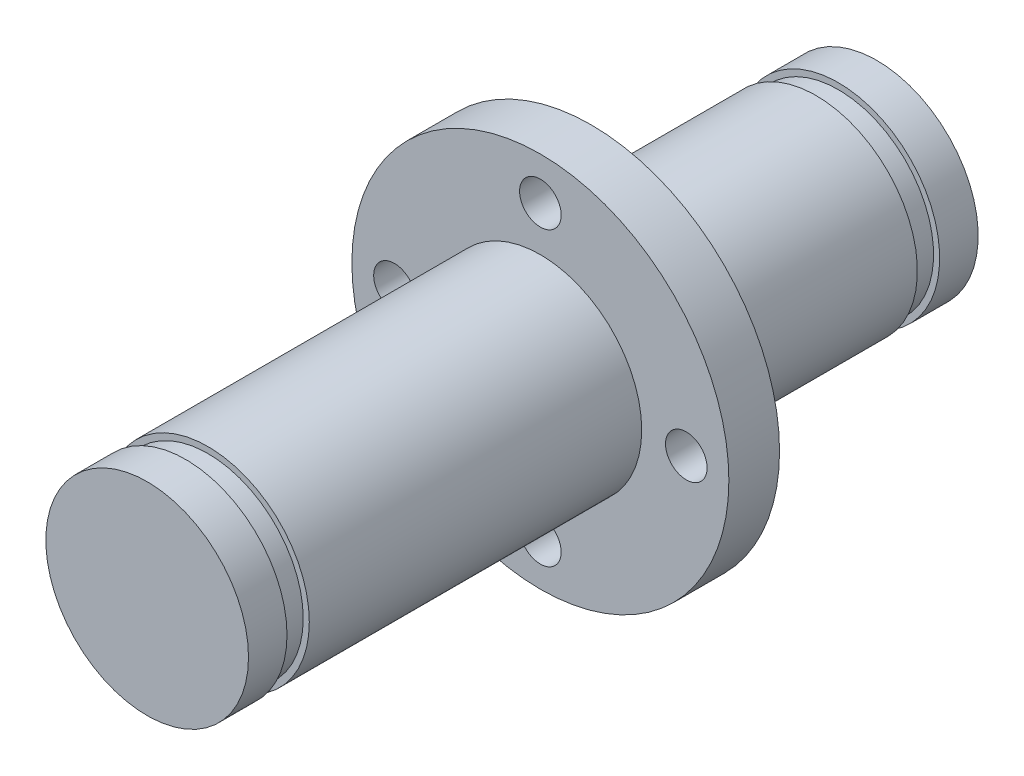
from build123d import *

# Parameters (mm, degrees)
SKETCH_1_R               = 5
EXTRUDE_1_DEPTH          = 19.4
SKETCH_2_R               = 9.3
EXTRUDE_2_DEPTH          = 2.5
EXTRUDE_START            = 14.1
SKETCH_3_R               = 5
EXTRUDE_3_DEPTH          = 14.1
SKETCH_5_W               = 0.3
SKETCH_5_H               = 1.1
SKETCH_6_W               = 0.3
SKETCH_6_H               = 1.1
HOLE_WIZARD_M2_5_2_D     = 2.05
HOLE_WIZARD_M2_5_2_DEPTH = 7.25
HOLE_WIZARD_M2_5_2_TIP   = 0.591784026
SKETCH_12_R              = 2
CUT_EXTRUDE_1_DEPTH      = 28


with BuildPart() as part:
    # 草图1 → 凸台-拉伸1 (new body)
    with BuildSketch(Plane.XY):
        Circle(SKETCH_1_R)
    extrude(amount=EXTRUDE_1_DEPTH)

    # 草图2 → 凸台-拉伸2 (add)
    with BuildSketch(Plane(origin=(0, 0, 0), x_dir=(-1, 0, 0), z_dir=(0, 0, -1))):
        Circle(SKETCH_2_R)
    extrude(amount=EXTRUDE_2_DEPTH)

    # 草图3 → 凸台-拉伸3 (add)
    with BuildSketch(Plane(origin=(0, 0, -2.5), x_dir=(-1, 0, 0), z_dir=(0, 0, -1)).offset(EXTRUDE_START)):
        with Locations(Location((0, 0, 0), (0, 0, 180))):
            Circle(SKETCH_3_R)
    extrude(amount=-EXTRUDE_3_DEPTH)

    # 草图5 → 切除-旋转3 (revolve, cut)
    with BuildSketch(Plane(origin=(0, 0, 0), x_dir=(1, 0, 0), z_dir=(0, 1, 0)), mode=Mode.PRIVATE) as cut_revolve_3_sk:
        with Locations((4.85, 14.15)):
            Rectangle(SKETCH_5_W, SKETCH_5_H)
    revolve(cut_revolve_3_sk.sketch.rotate(Axis((0, 0, -16.6), (0, 0, 1)), 180), axis=Axis((0, 0, -16.6), (0, 0, 1)), mode=Mode.SUBTRACT)

    # 草图6 → 切除-旋转4 (revolve, cut)
    with BuildSketch(Plane(origin=(0, 0, 0), x_dir=(1, 0, 0), z_dir=(0, 1, 0))):
        with Locations((4.85, -16.95)):
            Rectangle(SKETCH_6_W, SKETCH_6_H)
    revolve(axis=Axis((0, 0, 19.4), (0, 0, -1)), mode=Mode.SUBTRACT)

    # M2.5 螺纹孔2
    with Locations(Plane(origin=(0, 7.2, -2.5), x_dir=(-1, 0, 0), z_dir=(0, 0, -1))):
        with Locations((0, 0), (7.2, -7.2), (-7.2, -7.2), (0, -14.4)):
            Hole(HOLE_WIZARD_M2_5_2_D / 2, depth=HOLE_WIZARD_M2_5_2_DEPTH)
            with Locations((0, 0, -(HOLE_WIZARD_M2_5_2_DEPTH + HOLE_WIZARD_M2_5_2_TIP / 2))):  # 120° drill point
                Cone(0, HOLE_WIZARD_M2_5_2_D / 2, HOLE_WIZARD_M2_5_2_TIP, mode=Mode.SUBTRACT)

    # 草图12 → 切除-拉伸1 (cut)
    with BuildSketch(Plane(origin=(0, 0, -16.6), x_dir=(-1, 0, 0), z_dir=(0, 0, -1))):
        Circle(SKETCH_12_R)
    extrude(amount=-CUT_EXTRUDE_1_DEPTH, mode=Mode.SUBTRACT)


solid = part.part
